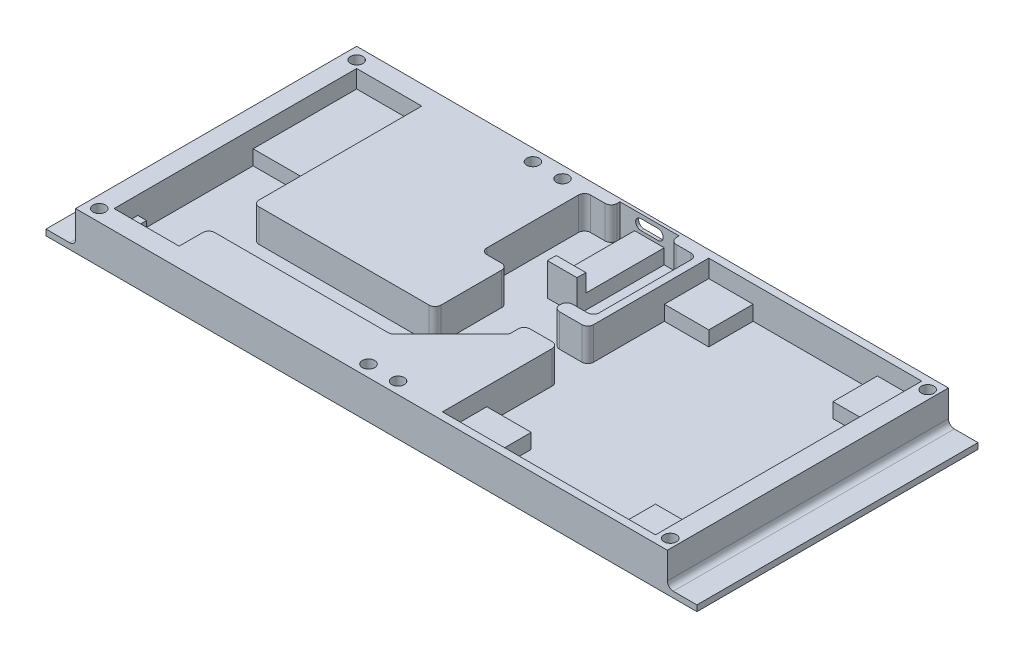
from build123d import *

# Parameters (mm, degrees)
SKETCH2_W           = 200
SKETCH2_H           = 95
BOSS_EXTRUDE1_DEPTH = 11
SKETCH3_W           = 200
SKETCH3_H           = 95
BOSS_EXTRUDE2_DEPTH = 2
SKETCH4_W           = 22
SKETCH4_H           = 35
SKETCH4_W_2         = 10
SKETCH4_H_2         = 26.5
SKETCH4_W_3         = 3
SKETCH4_H_3         = 8
SKETCH4_W_4         = 15
SKETCH4_H_4         = 15
BOSS_EXTRUDE3_DEPTH = 5
CUT_EXTRUDE1_DEPTH  = 7
SKETCH9_W           = 10
SKETCH9_H           = 3
BOSS_EXTRUDE4_DEPTH = 11
SKETCH7_W           = 220
SKETCH7_H           = 95
BOSS_EXTRUDE5_DEPTH = 2
FILLET1_R           = 2
FILLET2_R           = 2
SKETCH10_R          = 2.1
CUT_EXTRUDE2_DEPTH  = 6


with BuildPart() as part:
    # Sketch2 → Boss-Extrude1 (new body)
    with BuildSketch(Plane(origin=(0, 0, 0), x_dir=(1, 0, 0), z_dir=(0, 1, 0))):
        Rectangle(SKETCH2_W, SKETCH2_H)
        Polygon((21.5, 4.091136268), (21.5, 45), (93.5, 45), (93.5, -45), (21.5, -45), (21.5, -5.908863732), (10, -5.908863732), (10, -11), (-10, -31), (-71.5, -31), (-71.5, -41), (-93.5, -41), (-93.5, 41), (-71.5, 41), (-71.5, -16), (-10, -16), (-10, 8.5), (-19, 8.5), (-19, 43.5), (-10, 43.5), (-10, 46.5), (10, 46.5), (10, 43.5), (19, 43.5), (19, 8.5), (10, 8.5), (10, 4.091136268), align=None, mode=Mode.SUBTRACT)
    extrude(amount=BOSS_EXTRUDE1_DEPTH)

    # Sketch3 → Boss-Extrude2 (add)
    with BuildSketch(Plane.XZ):
        Rectangle(SKETCH3_W, SKETCH3_H)
    extrude(amount=BOSS_EXTRUDE2_DEPTH)

    # Sketch4 → Boss-Extrude3 (add)
    with BuildSketch(Plane(origin=(0, 0, 0), x_dir=(1, 0, 0), z_dir=(0, 1, 0))):
        with Locations((-82.5, 23.5)):
            Rectangle(SKETCH4_W, SKETCH4_H)
        with Locations((-0.04618168, 33.25)):
            Rectangle(SKETCH4_W_2, SKETCH4_H_2)
        with Locations((-92, -37)):
            Rectangle(SKETCH4_W_3, SKETCH4_H_3)
        with Locations((29, 37.5)):
            Rectangle(SKETCH4_W_4, SKETCH4_H_4)
        with Locations((86, 37.5)):
            Rectangle(SKETCH4_W_4, SKETCH4_H_4)
        with Locations((86, -37.5)):
            Rectangle(SKETCH4_W_4, SKETCH4_H_4)
        with Locations((29, -37.5)):
            Rectangle(SKETCH4_W_4, SKETCH4_H_4)
    extrude(amount=BOSS_EXTRUDE3_DEPTH)

    # Sketch5 → Cut-Extrude1 (cut)
    with BuildSketch(Plane.XY.offset(-46.5)):
        with BuildLine():
            Line((-2.94618168, 9.6), (2.85381832, 9.6))
            ThreePointArc((2.85381832, 9.6), (4.60381832, 7.85), (2.85381832, 6.1))
            Line((2.85381832, 6.1), (-2.94618168, 6.1))
            ThreePointArc((-2.94618168, 6.1), (-4.69618168, 7.85), (-2.94618168, 9.6))
        make_face()
    extrude(amount=-CUT_EXTRUDE1_DEPTH, mode=Mode.SUBTRACT)

    # Sketch9 → Boss-Extrude4 (add)
    with BuildSketch(Plane(origin=(0, 0, 0), x_dir=(1, 0, 0), z_dir=(0, 1, 0))):
        with Locations((-0.04618168, 18.5)):
            Rectangle(SKETCH9_W, SKETCH9_H)
    extrude(amount=BOSS_EXTRUDE4_DEPTH)

    # Sketch7 → Boss-Extrude5 (add)
    with BuildSketch(Plane.XZ.offset(2)):
        Rectangle(SKETCH7_W, SKETCH7_H)
    extrude(amount=-BOSS_EXTRUDE5_DEPTH)

    # Fillet1
    fillet1_edges = [part.edges().sort_by_distance(p)[0] for p in [
        (100, 0, 0),
        (-100, 0, 0),
    ]]
    fillet(fillet1_edges, radius=FILLET1_R)

    # Fillet2
    fillet2_edges = [part.edges().sort_by_distance(p)[0] for p in [
        (10, 5.5, -43.5),
        (-10, 5.5, -43.5),
        (-19, 5.5, -43.5),
        (-19, 5.5, -8.5),
        (-10, 5.5, -8.5),
        (-10, 5.5, 16),
        (-71.5, 5.5, 16),
        (-71.5, 5.5, 31),
        (-10, 5.5, 31),
        (10, 5.5, 11),
        (10, 5.5, 5.908863732),
        (21.5, 5.5, 5.908863732),
        (21.5, 5.5, -4.091136268),
        (10, 5.5, -4.091136268),
        (10, 5.5, -8.5),
        (19, 5.5, -8.5),
        (19, 5.5, -43.5),
    ]]
    fillet(fillet2_edges, radius=FILLET2_R)

    # Sketch10 → Cut-Extrude2 (cut)
    with BuildSketch(Plane(origin=(0, 11, 0), x_dir=(1, 0, 0), z_dir=(0, 1, 0))):
        with Locations(Location((-96, -43.5, 0), (0, 0, 270))):
            Circle(SKETCH10_R)
        with Locations(Location((-5, -43.5, 0), (0, 0, 270))):
            Circle(SKETCH10_R)
        with Locations(Location((5, -43.5, 0), (0, 0, 270))):
            Circle(SKETCH10_R)
        with Locations(Location((97, -43.5, 0), (0, 0, 270))):
            Circle(SKETCH10_R)
        with Locations(Location((97, 43.5, 0), (0, 0, 270))):
            Circle(SKETCH10_R)
        with Locations(Location((-26.428932188, 43.5, 0), (0, 0, 270))):
            Circle(SKETCH10_R)
        with Locations(Location((-36.428932188, 43.5, 0), (0, 0, 270))):
            Circle(SKETCH10_R)
        with Locations(Location((-96, 43.5, 0), (0, 0, 270))):
            Circle(SKETCH10_R)
    extrude(amount=-CUT_EXTRUDE2_DEPTH, mode=Mode.SUBTRACT)


solid = part.part
